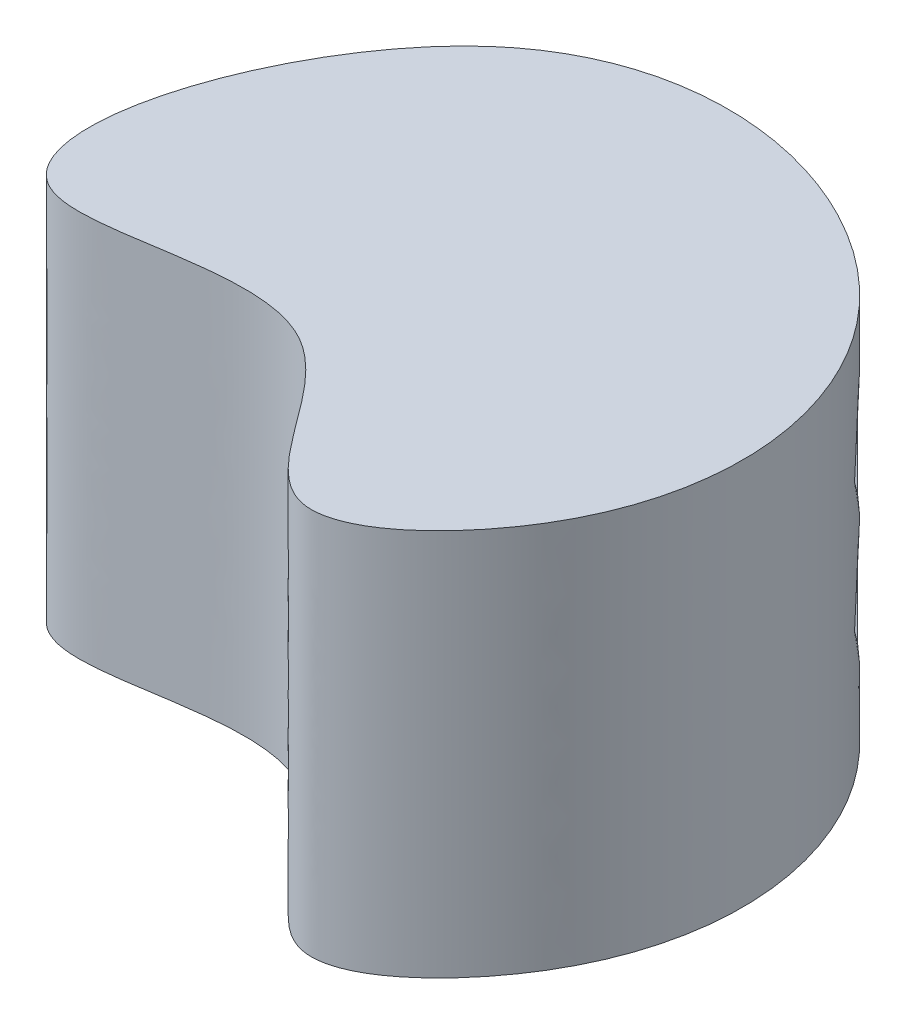
from build123d import *

# Parameters (mm, degrees)
EXTRUDE_1_DEPTH = 206


with BuildPart() as part:
    # 草图5 → 凸台-拉伸1 (new body)
    with BuildSketch(Plane(origin=(0, 0, 0), x_dir=(1, 0, 0), z_dir=(0, 1, 0))):
        with BuildLine():
            add(Edge.make_bspline(
                [(-448.17093282, -23.41202818), (-488.309119651, -3.858852709), (-412.463963268, 241.169084085), (-142.204306703, 170.743168755), (-120.897053342, -23.312767978), (-249.321738253, -139.726636041), (-301.658596983, 22.045671415), (-419.995995788, -37.137348907), (-448.17093282, -23.41202818)],
                knots=[0, 0, 0, 0, 0.206422898, 0.444934609, 0.641446637, 0.73737489, 0.855101772, 1, 1, 1, 1], degree=3))
        make_face()
    extrude(amount=EXTRUDE_1_DEPTH)


solid = part.part
